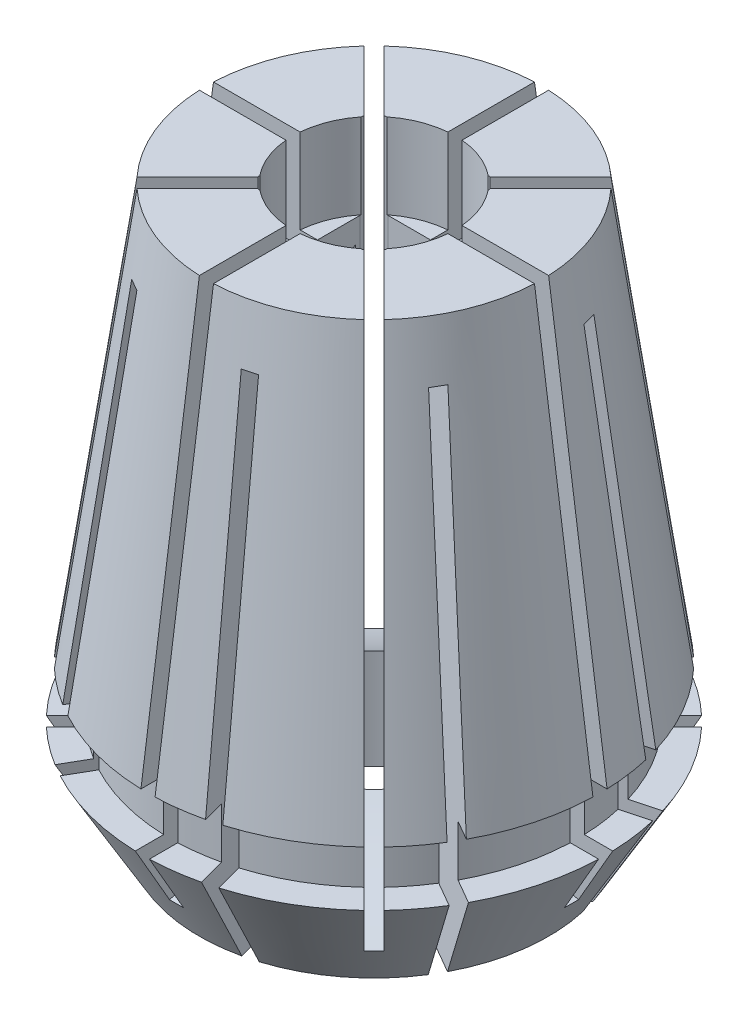
from build123d import *

# Parameters (mm, degrees)
EXTRUDE1_DEPTH    = 47.237646999
EXTRUDE2_DEPTH    = 0.5
CIRPATTERN1_COUNT = 8
EXTRUDE3_DEPTH    = 0.5
CIRPATTERN2_COUNT = 8


with BuildPart() as part:
    # Sketch7 → Revolve1 (revolve)
    with BuildSketch(Plane.XY):
        Polygon((11.868099205, 40.089364859), (5.75, 40.089364859), (5.75, 34.089364859), (3, 34.089364859), (3, 22.089364859), (6, 22.089364859), (6, 0.089364859), (12.358548116, 0.089364859), (16.4, 7.089364859), (14.395, 7.089364859), (14.395, 10.689364859), (16, 10.689364859), align=None)
    revolve(axis=Axis((0, 0, 0), (0, 1, 0)))

    # Sketch8 → Extrude1 (cut, through all)
    with BuildSketch(Plane(origin=(0, 40.089364859, 0), x_dir=(1, 0, 0), z_dir=(0, 1, 0))):
        with BuildLine():
            Line((3.5, 4.5), (-3.5, 4.5))
            ThreePointArc((-3.5, 4.5), (-4.207106781, 4.207106781), (-4.5, 3.5))
            Line((-4.5, 3.5), (-4.5, -3.5))
            ThreePointArc((-4.5, -3.5), (-4.207106781, -4.207106781), (-3.5, -4.5))
            Line((-3.5, -4.5), (3.5, -4.5))
            ThreePointArc((3.5, -4.5), (4.207106781, -4.207106781), (4.5, -3.5))
            Line((4.5, -3.5), (4.5, 3.5))
            ThreePointArc((4.5, 3.5), (4.207106781, 4.207106781), (3.5, 4.5))
        make_face()
    extrude(amount=-EXTRUDE1_DEPTH, mode=Mode.SUBTRACT)

    # Sketch9 → Extrude2 (cut, symmetric)
    with BuildSketch(Plane(origin=(0, 0, 0), x_dir=(0, 0, -1), z_dir=(1, 0, 0))):
        with BuildLine():
            Line((0, 47.419294494), (0, 20.719863821))
            ThreePointArc((0, 20.719863821), (18.36479414, 2.355069681), (36.72958828, 20.719863821))
            Line((36.72958828, 20.719863821), (36.72958828, 47.419294494))
            Line((36.72958828, 47.419294494), (0, 47.419294494))
        make_face()
    extrude2 = extrude(amount=EXTRUDE2_DEPTH, both=True, mode=Mode.SUBTRACT)

    # CirPattern1: Extrude2 ×8 about axis
    cirpattern1_axis = Axis((0, 22.089364859, 0), (0, -1, 0))
    for i in range(1, CIRPATTERN1_COUNT):
        add(extrude2.rotate(cirpattern1_axis, i * 360 / CIRPATTERN1_COUNT), mode=Mode.SUBTRACT)

    # 3DSketch1 → Extrude3 (cut, symmetric)
    with BuildSketch(Plane(origin=(0, -5.567249395, 0), x_dir=(-0.6814836970009862, 0.6170683060176774, -0.39345479591732285), z_dir=(0.5000000000000011, -7.664221877928312e-12, -0.866025403784438))):
        with BuildLine():
            Line((0, 0), (15.889668829, 20.263125962))
            ThreePointArc((15.889668829, 20.263125962), (38.941396421, 23.051727592), (41.729998051, 0))
            Line((41.729998051, 0), (25.840329222, -20.263125962))
            Line((25.840329222, -20.263125962), (0, 0))
        make_face()
    extrude3 = extrude(amount=EXTRUDE3_DEPTH, both=True, mode=Mode.SUBTRACT)

    # CirPattern2: Extrude3 ×8 about axis
    cirpattern2_axis = Axis((0, 22.089364859, 0), (0, -1, 0))
    for i in range(1, CIRPATTERN2_COUNT):
        add(extrude3.rotate(cirpattern2_axis, i * 360 / CIRPATTERN2_COUNT), mode=Mode.SUBTRACT)


solid = part.part
